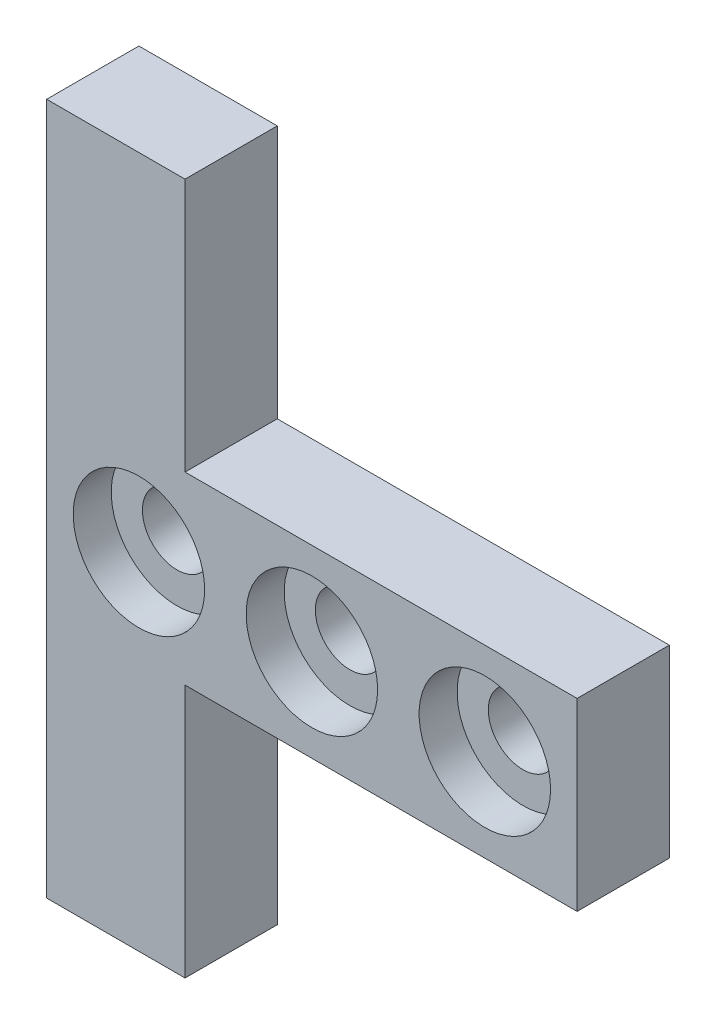
from build123d import *

# Parameters (mm, degrees)
CROQUIS2_R              = 1.5
SALIENTE_EXTRUIR1_DEPTH = 4
CROQUIS3_R              = 2.85
CORTAR_EXTRUIR1_DEPTH   = 1.65
CROQUIS4_W              = 4
CROQUIS4_H              = 11
CORTAR_EXTRUIR2_DEPTH   = 2


with BuildPart() as part:
    # Croquis2 → Saliente-Extruir1 (new body)
    with BuildSketch(Plane.XY):
        Polygon((38.497217209, -204.70543153), (46.497217209, -204.70543153), (46.497217209, -193.70543153), (61.497217209, -193.70543153), (61.497217209, -185.70543153), (46.497217209, -185.70543153), (46.497217209, -174.70543153), (38.497217209, -174.70543153), align=None)
        with Locations((42.497217209, -189.70543153)):
            Circle(CROQUIS2_R, mode=Mode.SUBTRACT)
        with Locations((57.497217209, -189.70543153)):
            Circle(CROQUIS2_R, mode=Mode.SUBTRACT)
        with Locations((49.997217209, -189.70543153)):
            Circle(CROQUIS2_R, mode=Mode.SUBTRACT)
    extrude(amount=SALIENTE_EXTRUIR1_DEPTH)

    # Croquis3 → Cortar-Extruir1 (cut)
    with BuildSketch(Plane.XY.offset(4)):
        with Locations((42.497217209, -189.70543153)):
            Circle(CROQUIS3_R)
        with Locations((49.997217209, -189.70543153)):
            Circle(CROQUIS3_R)
        with Locations((57.497217209, -189.70543153)):
            Circle(CROQUIS3_R)
    extrude(amount=-CORTAR_EXTRUIR1_DEPTH, mode=Mode.SUBTRACT)

    # Croquis4 → Cortar-Extruir2 (cut)
    with BuildSketch(Plane(origin=(46.497217209, 0, 0), x_dir=(0, 0, -1), z_dir=(1, 0, 0))):
        with Locations((-2, -199.20543153)):
            Rectangle(CROQUIS4_W, CROQUIS4_H)
        with Locations((-2, -180.20543153)):
            Rectangle(CROQUIS4_W, CROQUIS4_H)
    extrude(amount=-CORTAR_EXTRUIR2_DEPTH, mode=Mode.SUBTRACT)


solid = part.part
